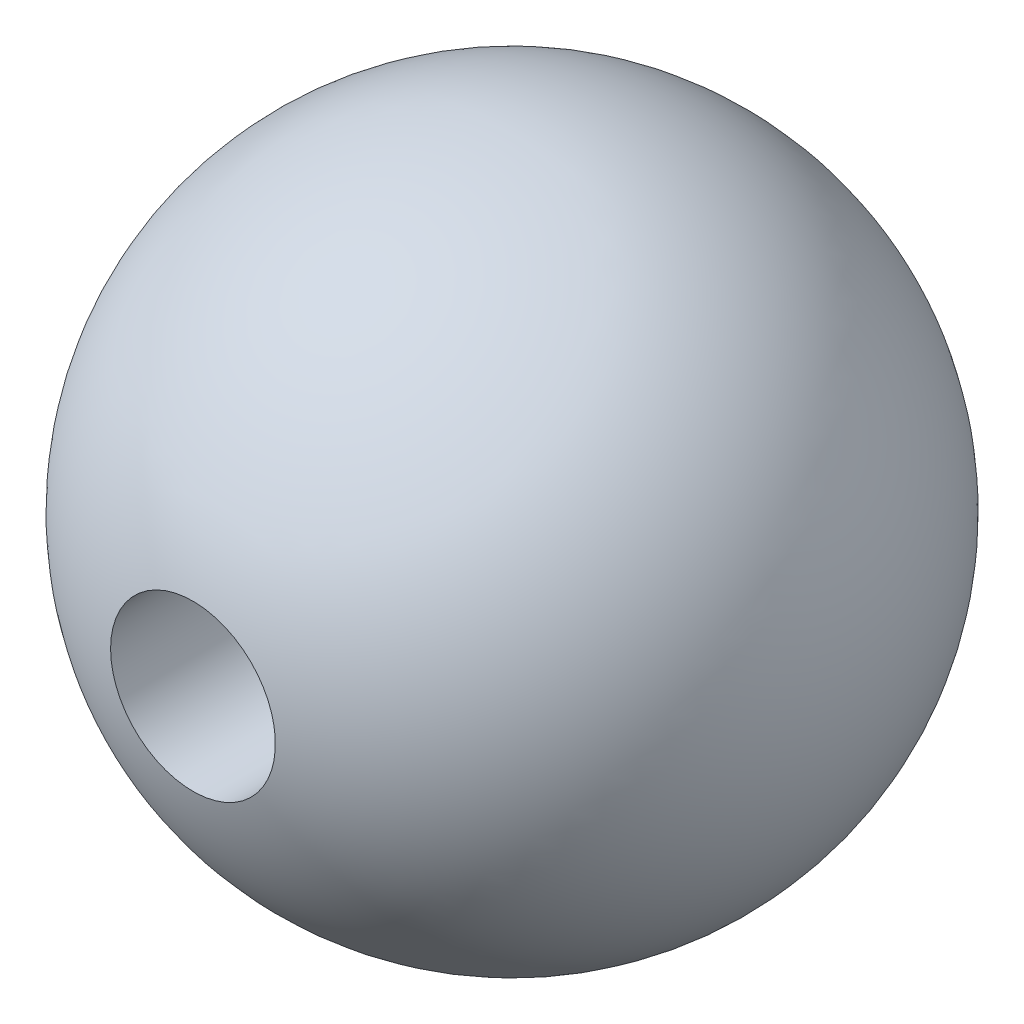
from build123d import *

# Parameters (mm, degrees)
SKETCH2_R          = 1.5875
CUT_EXTRUDE1_DEPTH = 12.7


with BuildPart() as part:
    # Sketch1 → Revolve1 (revolve)
    with BuildSketch(Plane.XY):
        with BuildLine():
            Line((0, -6.35), (0, 6.35))
            ThreePointArc((0, 6.35), (6.35, 0), (0, -6.35))
        make_face()
    revolve(axis=Axis((0, -6.35, 0), (0, 1, 0)))

    # Sketch2 → Cut-Extrude1 (cut, symmetric)
    with BuildSketch(Plane.XY):
        with Locations(Location((0, 0, 0), (0, 0, 180))):
            Circle(SKETCH2_R)
    extrude(amount=CUT_EXTRUDE1_DEPTH, both=True, mode=Mode.SUBTRACT)


solid = part.part
